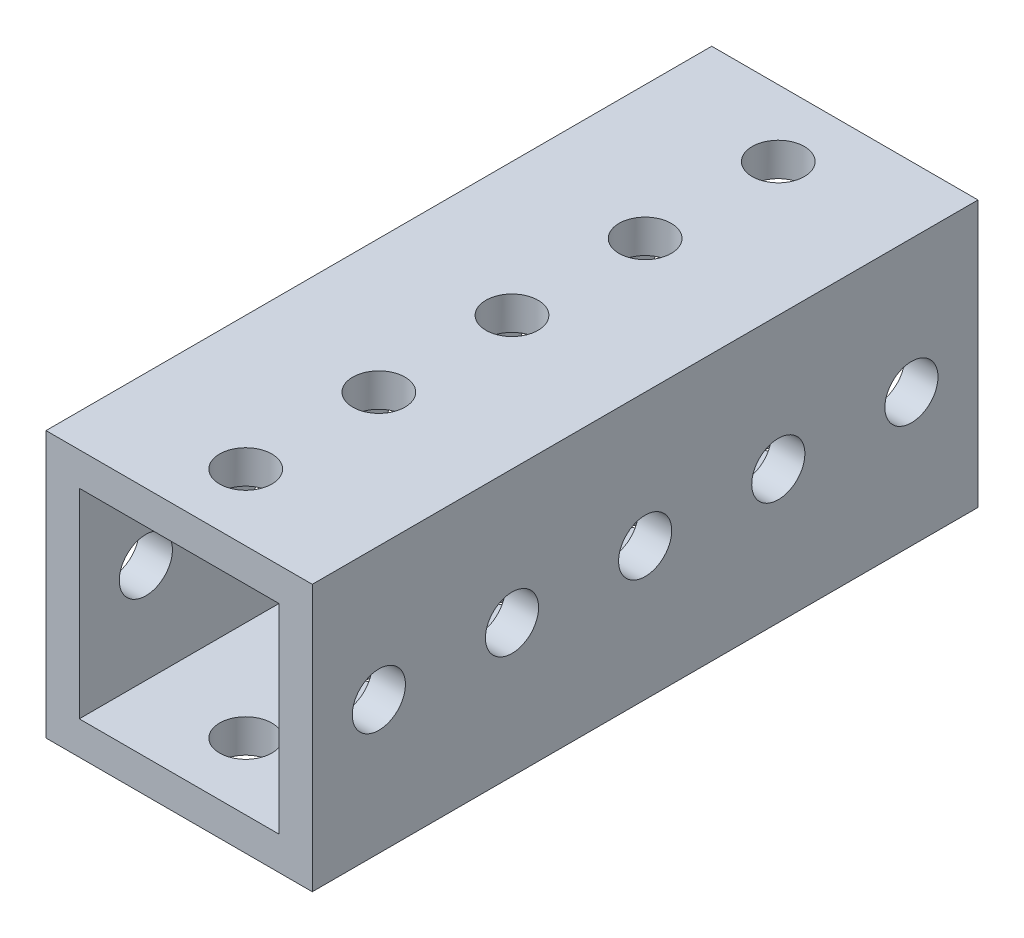
from build123d import *

# Parameters (mm, degrees)
SKETCH1_W           = 25.4
SKETCH1_H           = 25.4
BOSS_EXTRUDE1_DEPTH = 63.5
SHELL1_T            = -3.175
SKETCH2_R           = 2.4892
CUT_EXTRUDE1_DEPTH  = 63.5
SKETCH3_R           = 2.53492
CUT_EXTRUDE2_DEPTH  = 63.5


with BuildPart() as part:
    # Sketch1 → Boss-Extrude1 (new body)
    with BuildSketch(Plane.XY):
        with Locations((12.7, 12.7)):
            Rectangle(SKETCH1_W, SKETCH1_H)
    extrude(amount=BOSS_EXTRUDE1_DEPTH)

    # Shell1
    shell1_openings = [part.faces().sort_by_distance(p)[0] for p in [
        (12.7, 12.7, 63.5),
        (12.7, 12.7, 0),
    ]]
    offset(amount=SHELL1_T, openings=shell1_openings, kind=Kind.INTERSECTION)

    # Sketch2 → Cut-Extrude1 (cut)
    with BuildSketch(Plane(origin=(0, 25.4, 0), x_dir=(1, 0, 0), z_dir=(0, 1, 0))):
        with Locations(Location((12.7, -6.35, 0), (0, 0, 270))):
            Circle(SKETCH2_R)
        with Locations(Location((12.7, -19.05, 0), (0, 0, 270))):
            Circle(SKETCH2_R)
        with Locations(Location((12.7, -31.75, 0), (0, 0, 270))):
            Circle(SKETCH2_R)
        with Locations(Location((12.7, -44.45, 0), (0, 0, 270))):
            Circle(SKETCH2_R)
        with Locations(Location((12.7, -57.15, 0), (0, 0, 270))):
            Circle(SKETCH2_R)
    extrude(amount=-CUT_EXTRUDE1_DEPTH, mode=Mode.SUBTRACT)

    # Sketch3 → Cut-Extrude2 (cut)
    with BuildSketch(Plane(origin=(25.4, 0, 0), x_dir=(0, 0, -1), z_dir=(1, 0, 0))):
        with Locations(Location((-57.15, 12.7, 0), (0, 0, 90))):
            Circle(SKETCH3_R)
        with Locations(Location((-44.45, 12.7, 0), (0, 0, 90))):
            Circle(SKETCH3_R)
        with Locations(Location((-31.75, 12.7, 0), (0, 0, 90))):
            Circle(SKETCH3_R)
        with Locations(Location((-19.05, 12.7, 0), (0, 0, 90))):
            Circle(SKETCH3_R)
        with Locations(Location((-6.35, 12.7, 0), (0, 0, 90))):
            Circle(SKETCH3_R)
    extrude(amount=-CUT_EXTRUDE2_DEPTH, mode=Mode.SUBTRACT)


solid = part.part
